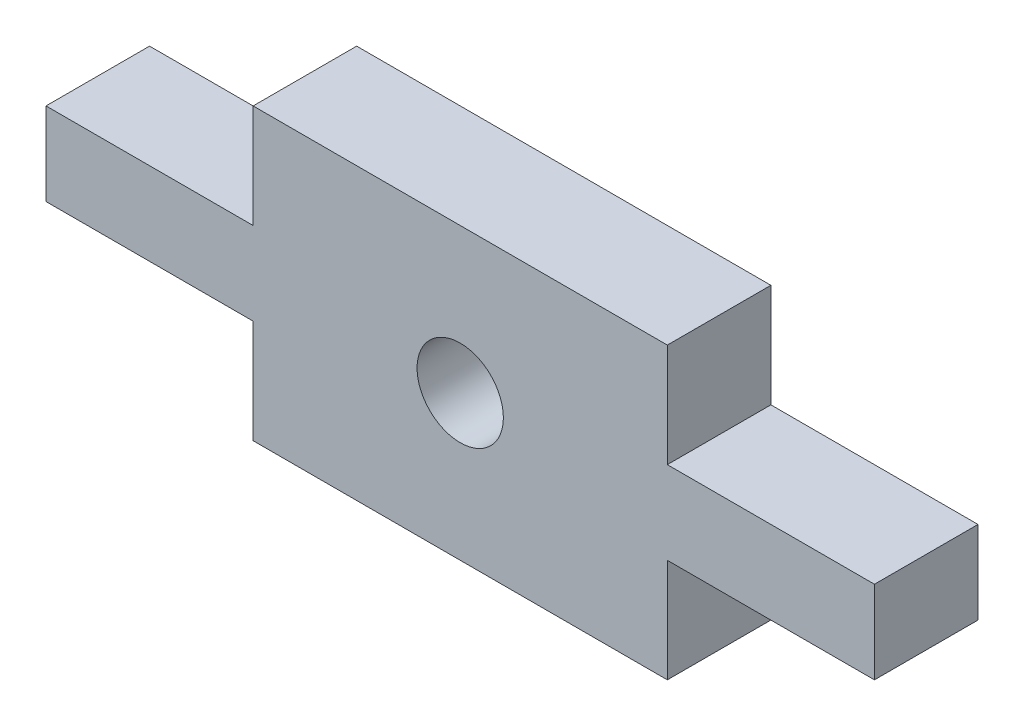
from build123d import *

# Parameters (mm, degrees)
SKETCH_1_R      = 1.25
EXTRUDE_1_DEPTH = 3


with BuildPart() as part:
    # 草圖1 → 填料-伸長1 (new body)
    with BuildSketch(Plane.XY):
        Polygon((218.799471831, 139.984082037), (218.799365765, 136.984040098), (206.799410135, 136.984110808), (206.79937478, 139.98415275), (200.799361609, 139.98415275), (200.799389894, 142.384214587), (206.799403063, 142.384073165), (206.799579842, 145.384185814), (218.79946476, 145.384044393), (218.799429403, 142.383931742), (224.799442574, 142.383931742), (224.799414289, 139.983869905), align=None)
        with Locations((212.799472803, 141.184112956)):
            Circle(SKETCH_1_R, mode=Mode.SUBTRACT)
    extrude(amount=EXTRUDE_1_DEPTH)


solid = part.part
